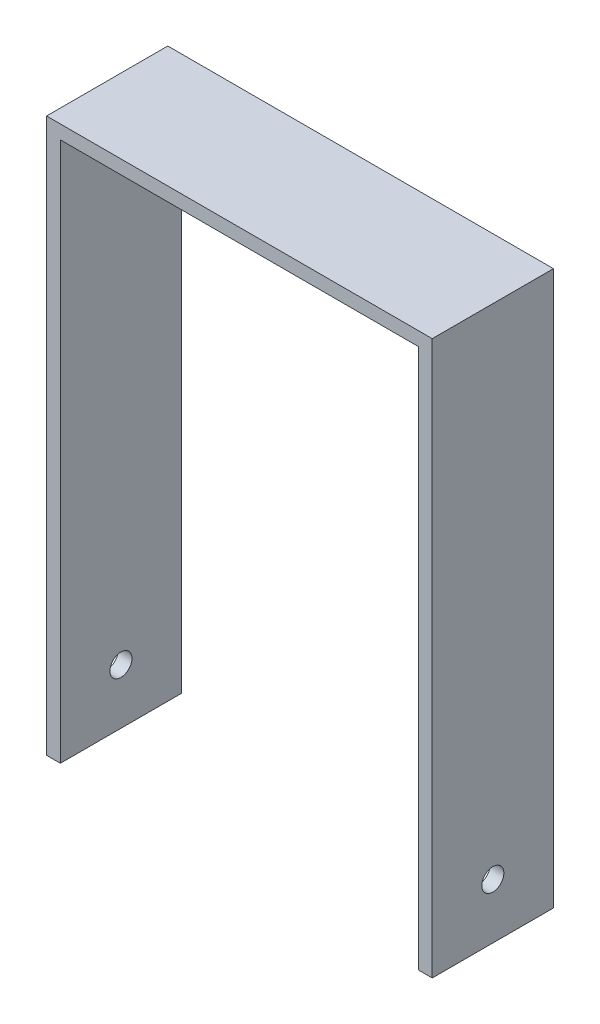
from build123d import *

# Parameters (mm, degrees)
CROQUIS1_W                 = 22
CROQUIS1_H                 = 100.5
CROQUIS1_R                 = 2
SALIENTE_EXTRUIR1_DEPTH    = 35
CORTAR_EXTRUIR2_DEPTH      = 100.494974747
CORTAR_EXTRUIR2_DEPTH_BACK = 100.494974747
CROQUIS3_W                 = 65
CROQUIS3_H                 = 13
CROQUIS3_R                 = 2.5
SALIENTE_EXTRUIR3_DEPTH    = 3


with BuildPart() as part:
    # Croquis1 → Saliente-Extruir1 (new, symmetric)
    with BuildSketch(Plane(origin=(0, 0, 0), x_dir=(0, 0, -1), z_dir=(1, 0, 0))):
        with Locations((0, 40.25)):
            Rectangle(CROQUIS1_W, CROQUIS1_H)
        Circle(CROQUIS1_R, mode=Mode.SUBTRACT)
    extrude(amount=SALIENTE_EXTRUIR1_DEPTH, both=True)

    # Croquis2 → Cortar-Extruir2 (cut, two sides: drawn at the far end of the back side and taken through both)
    with BuildSketch(Plane.XY.offset(11).offset(-CORTAR_EXTRUIR2_DEPTH_BACK)):
        Polygon((32.5, -262.128065288), (32.5, -10), (32.5, 88), (-32.5, 88), (-32.5, -10), (-32.5, -262.128065288), (-32.5, -766.384195863), (32.5, -766.384195863), align=None)
    extrude(amount=CORTAR_EXTRUIR2_DEPTH + CORTAR_EXTRUIR2_DEPTH_BACK, mode=Mode.SUBTRACT)

    # Croquis3 → Saliente-Extruir3 (add)
    with BuildSketch(Plane(origin=(0, 0, -11), x_dir=(-1, 0, 0), z_dir=(0, 0, -1))):
        with Locations((0, 81.5)):
            Rectangle(CROQUIS3_W, CROQUIS3_H)
        with Locations(Location((0, 81.5, 0), (0, 0, 90))):
            Circle(CROQUIS3_R, mode=Mode.SUBTRACT)
    extrude(amount=-SALIENTE_EXTRUIR3_DEPTH)


solid = part.part
